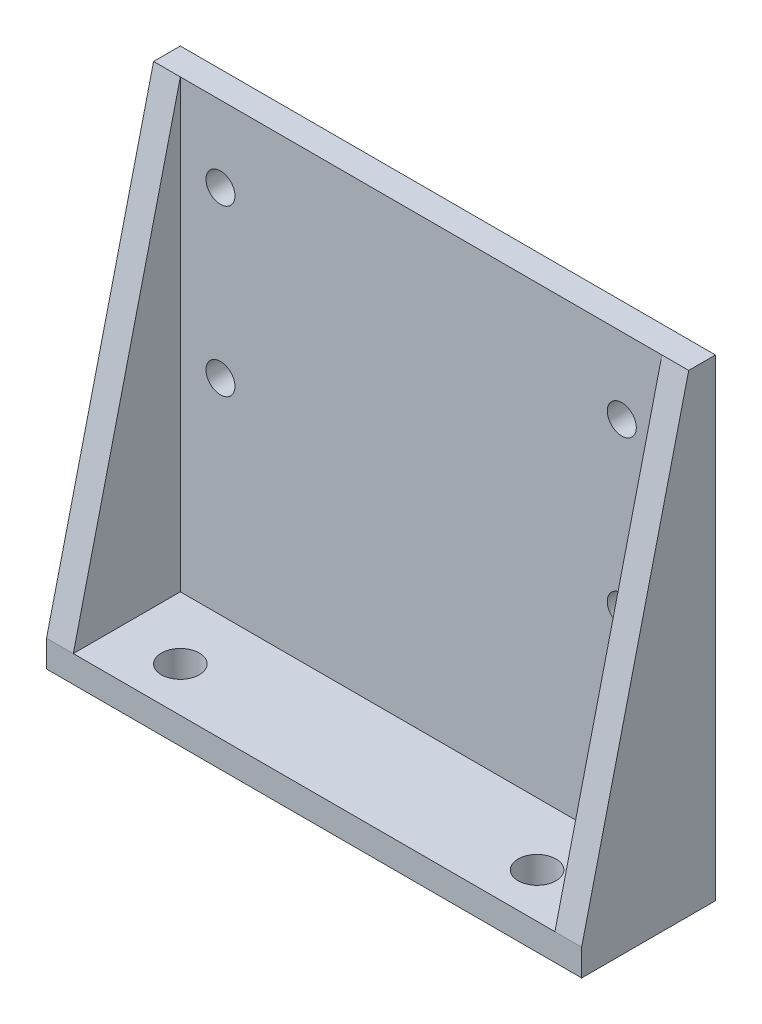
from build123d import *

# Parameters (mm, degrees)
SKETCH1_W           = 60
SKETCH1_H           = 15
SKETCH1_R           = 2.125
BOSS_EXTRUDE1_DEPTH = 3
SKETCH2_W           = 60
SKETCH2_H           = 50
SKETCH2_R           = 1.625
BOSS_EXTRUDE2_DEPTH = 3
BOSS_EXTRUDE3_DEPTH = 3


with BuildPart() as part:
    # Sketch1 → Boss-Extrude1 (new body)
    with BuildSketch(Plane(origin=(0, 0, 0), x_dir=(1, 0, 0), z_dir=(0, 1, 0))):
        with Locations((30, 7.5)):
            Rectangle(SKETCH1_W, SKETCH1_H)
        with Locations(Location((10, 5, 0), (0, 0, 270))):
            Circle(SKETCH1_R, mode=Mode.SUBTRACT)
        with Locations(Location((50, 5, 0), (0, 0, 90))):
            Circle(SKETCH1_R, mode=Mode.SUBTRACT)
    extrude(amount=BOSS_EXTRUDE1_DEPTH)

    # Sketch2 → Boss-Extrude2 (add)
    with BuildSketch(Plane(origin=(0, 0, -15), x_dir=(-1, 0, 0), z_dir=(0, 0, -1))):
        with Locations((-30, 28)):
            Rectangle(SKETCH2_W, SKETCH2_H)
        with Locations((-52.5, 44.5)):
            Circle(SKETCH2_R, mode=Mode.SUBTRACT)
        with Locations((-52.5, 26)):
            Circle(SKETCH2_R, mode=Mode.SUBTRACT)
        with Locations(Location((-7.5, 26, 0), (0, 0, 180))):
            Circle(SKETCH2_R, mode=Mode.SUBTRACT)
        with Locations(Location((-7.5, 44.5, 0), (0, 0, 180))):
            Circle(SKETCH2_R, mode=Mode.SUBTRACT)
    extrude(amount=-BOSS_EXTRUDE2_DEPTH)

    # Sketch3 → Boss-Extrude3 (add)
    with BuildSketch(Plane.ZY):
        Polygon((-12, 53), (0, 3), (-12, 3), align=None)
    boss_extrude3 = extrude(amount=-BOSS_EXTRUDE3_DEPTH)

    # Mirror1: Boss-Extrude3 across plane
    add(boss_extrude3.mirror(Plane.ZY.offset(-30)))


solid = part.part
